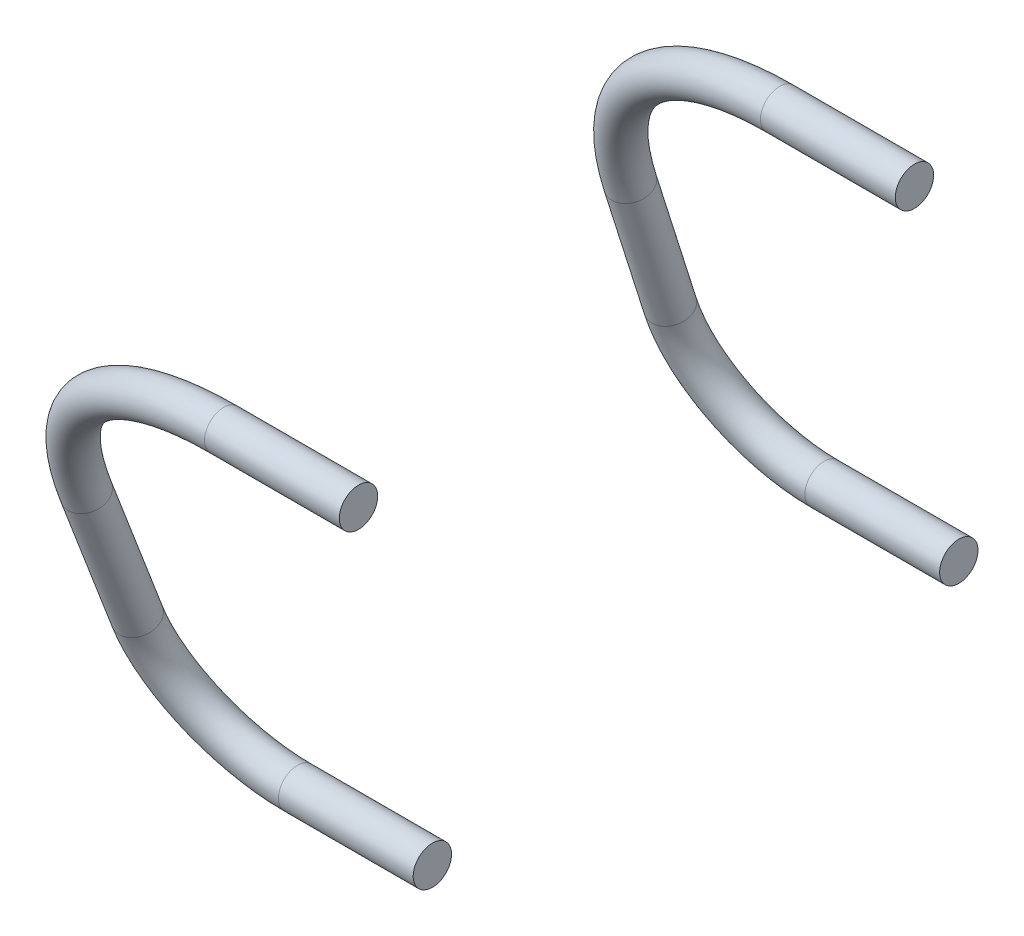
from build123d import *

# Parameters (mm, degrees)
SKETCH_3_R = 1.95
SKETCH_5_R = 1.95


with BuildPart() as part:
    # ｽｲｰﾌﾟ1: sweep along a path in ｽｹｯﾁ2
    with BuildLine(Plane(origin=(0, 6.787427417, -21.433981318), x_dir=(1, 0, 0), z_dir=(0, -0.3018917046944018, 0.9533422253507438))) as sweep_1_path:
        Line((-123.043127582, 29.593331579), (-136.743127582, 29.593331579))
        ThreePointArc((-136.743127582, 29.593331579), (-152.116139388, 23.225621594), (-158.483849372, 7.852609789))
        Line((-158.483849372, 7.852609789), (-158.483849372, -5.609025354))
        ThreePointArc((-158.483849372, -5.609025354), (-154.969130746, -14.094306728), (-146.483849372, -17.609025354))
        Line((-146.483849372, -17.609025354), (-132.783849372, -17.609025354))
    # ｽｹｯﾁ3 → ｽｲｰﾌﾟ1 (sweep)
    with BuildSketch(Plane(origin=(-123.043127582, 0, 0), x_dir=(0, 0, -1), z_dir=(1, 0, 0))):
        with Locations((12.5, 35)):
            Circle(SKETCH_3_R)
    sweep(path=sweep_1_path.line)


with BuildPart() as body_2:
    # ｽｲｰﾌﾟ2: sweep along a path in ｽｹｯﾁ4
    with BuildLine(Plane(origin=(0, -10.221603294, 26.665052071), x_dir=(1, 0, 0), z_dir=(0, -0.3579360116324533, 0.9337461173020492))) as sweep_2_path:
        Line((-123.043127582, 48.430298617), (-136.743127582, 48.430298617))
        ThreePointArc((-136.743127582, 48.430298617), (-152.116139388, 42.062588633), (-158.483849372, 26.689576827))
        Line((-158.483849372, 26.689576827), (-158.483849372, 12.237327138))
        ThreePointArc((-158.483849372, 12.237327138), (-154.969130746, 3.752045764), (-146.483849372, 0.237327138))
        Line((-146.483849372, 0.237327138), (-132.783849372, 0.237327138))
    # ｽｹｯﾁ5 → ｽｲｰﾌﾟ2 (sweep)
    with BuildSketch(Plane(origin=(-123.043127582, 0, 0), x_dir=(0, 0, -1), z_dir=(1, 0, 0))):
        with Locations((-44, 35)):
            Circle(SKETCH_5_R)
    sweep(path=sweep_2_path.line)


solid = Compound([part.part, body_2.part])
